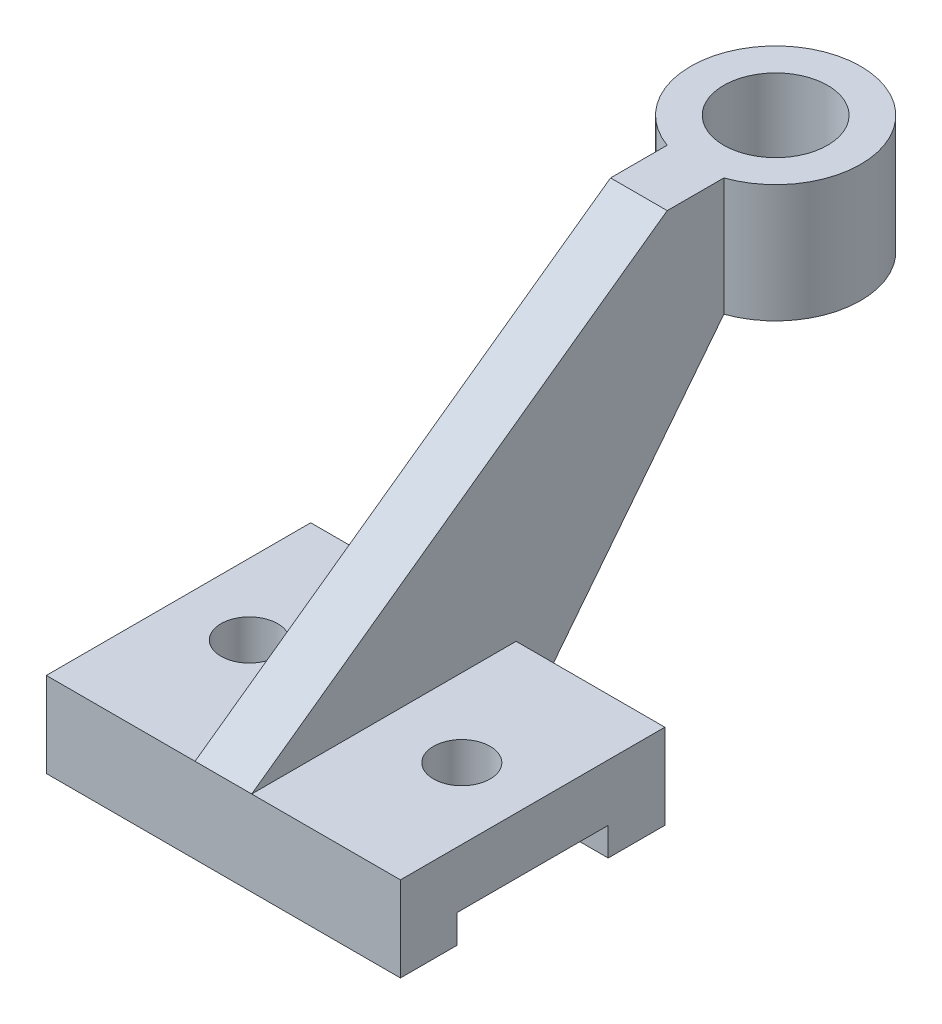
from build123d import *

# Parameters (mm, degrees)
SKETCH1_W           = 56
SKETCH1_H           = 18
BOSS_EXTRUDE1_DEPTH = 75
SKETCH2_R           = 6
CUT_EXTRUDE1_DEPTH  = 75
SKETCH3_W           = 32
SKETCH3_H           = 6
CUT_EXTRUDE2_DEPTH  = 75
BOSS_EXTRUDE5_DEPTH = 6
SKETCH23_R          = 18
SKETCH23_R_2        = 11
BOSS_EXTRUDE7_DEPTH = 25


with BuildPart() as part:
    # Sketch1 → Boss-Extrude1 (new body)
    with BuildSketch(Plane(origin=(0, 0, 0), x_dir=(0, 0, -1), z_dir=(1, 0, 0))):
        with Locations((5.509433962, 9)):
            Rectangle(SKETCH1_W, SKETCH1_H)
    extrude(amount=-BOSS_EXTRUDE1_DEPTH)

    # Sketch2 → Cut-Extrude1 (cut)
    with BuildSketch(Plane(origin=(0, 18, 0), x_dir=(1, 0, 0), z_dir=(0, 1, 0))):
        with Locations(Location((-15, 5.509433962, 0), (0, 0, 270))):
            Circle(SKETCH2_R)
        with Locations(Location((-60, 5.509433962, 0), (0, 0, 270))):
            Circle(SKETCH2_R)
    extrude(amount=-CUT_EXTRUDE1_DEPTH, mode=Mode.SUBTRACT)

    # Sketch3 → Cut-Extrude2 (cut)
    with BuildSketch(Plane(origin=(0, 0, 0), x_dir=(0, 0, -1), z_dir=(1, 0, 0))):
        with Locations((5.509433962, 3)):
            Rectangle(SKETCH3_W, SKETCH3_H)
    extrude(amount=-CUT_EXTRUDE2_DEPTH, mode=Mode.SUBTRACT)


with BuildPart() as part_1:
    # Body-Move/Copy1: moved
    add(part.part.moved(Location((37.5, 0, 0))))

    # Sketch4 → Boss-Extrude5 (add, symmetric)
    with BuildSketch(Plane(origin=(0, 0, 0), x_dir=(0, 0, -1), z_dir=(1, 0, 0))):
        Polygon((65.509433962, 81), (-22.490566038, 18), (33.509433962, 18), (33.509433962, 0), (77.509433962, 56), (77.509433962, 81), align=None)
    extrude(amount=BOSS_EXTRUDE5_DEPTH, both=True)

    # Sketch23 → Boss-Extrude7 (add)
    with BuildSketch(Plane(origin=(0, 81, 0), x_dir=(1, 0, 0), z_dir=(0, 1, 0))):
        with Locations((0, 94.479996711)):
            Circle(SKETCH23_R)
        with Locations(Location((0, 94.479996711, 0), (0, 0, 270))):
            Circle(SKETCH23_R_2, mode=Mode.SUBTRACT)
    extrude(amount=-BOSS_EXTRUDE7_DEPTH)


solid = part_1.part
